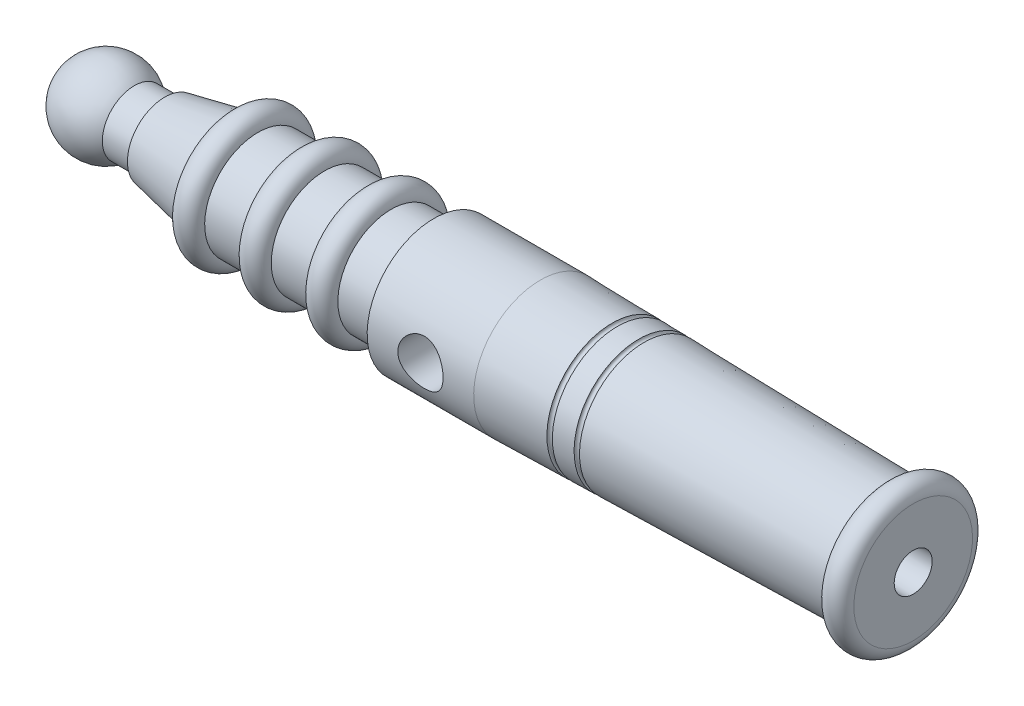
from build123d import *

# Parameters (mm, degrees)
CUT_EXTRUDE1_DEPTH      = 161.661782285
CUT_EXTRUDE1_DEPTH_BACK = 161.661782285
SKETCH2_R               = 4.25


with BuildPart() as part:
    # Sketch1 → Revolve2 (revolve)
    with BuildSketch(Plane.XY, mode=Mode.PRIVATE) as revolve2_sk:
        with BuildLine():
            Line((1.5e-08, -1e-09), (109.502717341, -1e-09))
            Line((109.502717341, -1e-09), (109.502717341, 2.99594403))
            Line((109.502717341, 2.99594403), (159.49949301, 3.563766762))
            Line((159.49949301, 3.563766762), (159.49949301, 11.140381428))
            ThreePointArc((159.49949301, 11.140381428), (157.024667491, 13.640254674), (154.500000014, 11.190727838))
            Line((154.500000014, 11.190727838), (108.969730701, 12.107828055))
            ThreePointArc((108.969730701, 12.107828055), (108.459661419, 11.607929455), (107.970136262, 12.127962534))
            Line((107.970136262, 12.127962534), (103.969730701, 12.208541298))
            ThreePointArc((103.969730701, 12.208541298), (103.459661419, 11.708642699), (102.970136262, 12.228675777))
            Line((102.970136262, 12.228675777), (89.500000014, 12.499999999))
            Line((89.500000014, 12.499999999), (69.500000014, 12.499999999))
            Line((69.500000014, 12.499999999), (69.500000015, 9.999999999))
            Line((69.500000015, 9.999999999), (61.500000015, 9.999999999))
            ThreePointArc((61.500000015, 9.999999999), (59.000000015, 12.499999999), (56.500000015, 9.999999999))
            Line((56.500000015, 9.999999999), (49.000000015, 9.999999999))
            ThreePointArc((49.000000015, 9.999999999), (46.500000015, 12.499999999), (44.000000015, 9.999999998))
            Line((44.000000015, 9.999999998), (36.500000015, 9.999999998))
            ThreePointArc((36.500000015, 9.999999998), (33.75365597, 12.487833315), (31.548548326, 9.509709661))
            Line((31.548548326, 9.509709661), (19.000000015, 6.999999999))
            Line((19.000000015, 6.999999999), (19.000000015, 5.999999999))
            Line((19.000000015, 5.999999999), (13.291502636, 5.999999999))
            ThreePointArc((13.291502636, 5.999999999), (4.708497393, 7.29150262), (1.5e-08, -1e-09))
        make_face()
    revolve(revolve2_sk.sketch.rotate(Axis((1.5e-08, -1e-09, 0), (1, 0, 0)), 180), axis=Axis((1.5e-08, -1e-09, 0), (1, 0, 0)))

    # Sketch2 → Cut-Extrude1 (cut, two sides: drawn at the far end of the back side and taken through both)
    with BuildSketch(Plane.XY.offset(-CUT_EXTRUDE1_DEPTH_BACK)):
        with Locations((79.500000014, 0)):
            Circle(SKETCH2_R)
    extrude(amount=CUT_EXTRUDE1_DEPTH + CUT_EXTRUDE1_DEPTH_BACK, mode=Mode.SUBTRACT)


solid = part.part
